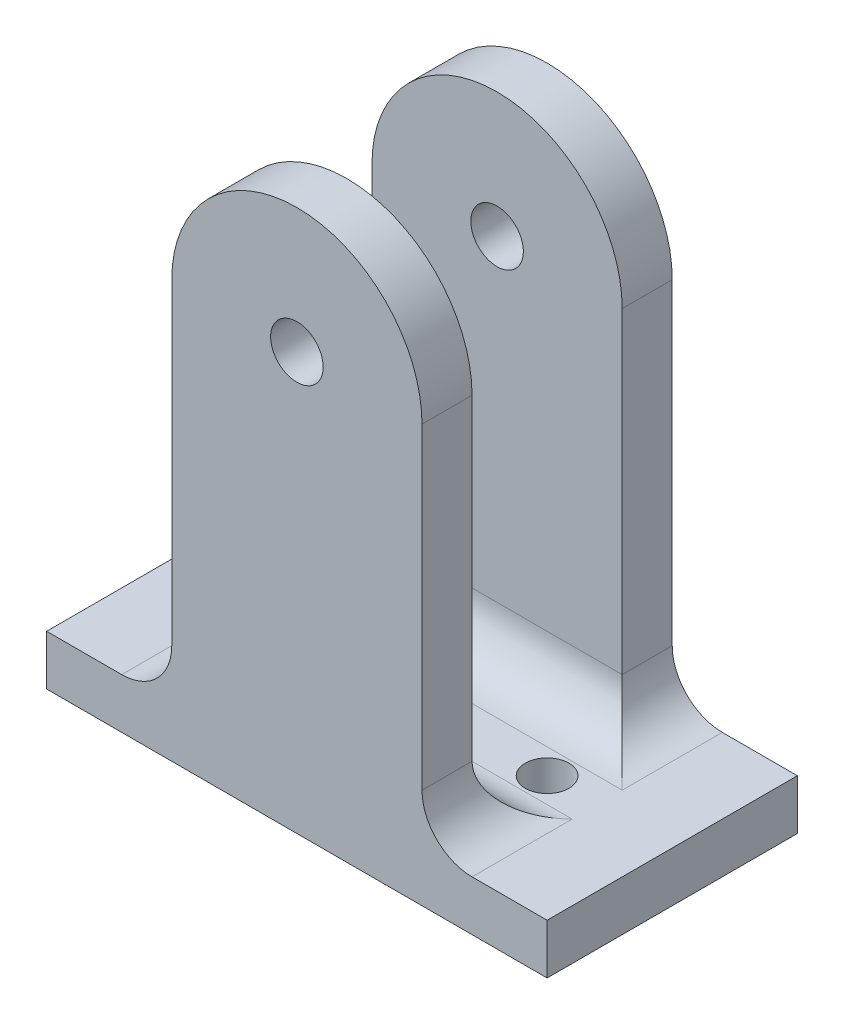
from build123d import *

# Parameters (mm, degrees)
SKETCH1_W            = 76.2
SKETCH1_H            = 38.1
SKETCH1_R            = 3.3274
BOSS_EXTRUDE1_DEPTH  = 7.62
SKETCH2_R            = 4
BOSS_EXTRUDE2_DEPTH  = 7.62
FILLET1_R            = 7.62
FILLET1_OF_MIRROR2_R = 7.62


with BuildPart() as part:
    # Sketch1 → Boss-Extrude1 (new body)
    with BuildSketch(Plane(origin=(0, 0, 0), x_dir=(1, 0, 0), z_dir=(0, 1, 0))):
        with Locations((38.1, 19.05)):
            Rectangle(SKETCH1_W, SKETCH1_H)
        with Locations(Location((19.05, 19.05, 0), (0, 0, 270))):
            Circle(SKETCH1_R, mode=Mode.SUBTRACT)
        with Locations(Location((57.15, 19.05, 0), (0, 0, 90))):
            Circle(SKETCH1_R, mode=Mode.SUBTRACT)
    extrude(amount=BOSS_EXTRUDE1_DEPTH)

    # Sketch2 → Boss-Extrude2 (add)
    with BuildSketch(Plane.XY):
        with BuildLine():
            Line((19.05, 0), (19.05, 63.5))
            ThreePointArc((19.05, 63.5), (38.1, 82.55), (57.15, 63.5))
            Line((57.15, 63.5), (57.15, 0))
            Line((57.15, 0), (19.05, 0))
        make_face()
        with Locations((38.1, 63.5)):
            Circle(SKETCH2_R, mode=Mode.SUBTRACT)
    boss_extrude2 = extrude(amount=-BOSS_EXTRUDE2_DEPTH)

    # Fillet1
    fillet1_edges = [part.edges().sort_by_distance(p)[0] for p in [
        (19.05, 7.62, -3.81),
        (57.15, 7.62, -3.81),
        (38.1, 7.62, -7.62),
    ]]
    fillet(fillet1_edges, radius=FILLET1_R)

    # Mirror2: Boss-Extrude2 across plane
    add(boss_extrude2.mirror(Plane.XY.offset(-19.05)))

    # Fillet1 of Mirror2
    fillet1_of_mirror2_edges = [part.edges().sort_by_distance(p)[0] for p in [
        (19.05, 7.62, -34.29),
        (57.15, 7.62, -34.29),
        (38.1, 7.62, -30.48),
    ]]
    fillet(fillet1_of_mirror2_edges, radius=FILLET1_OF_MIRROR2_R)


solid = part.part
